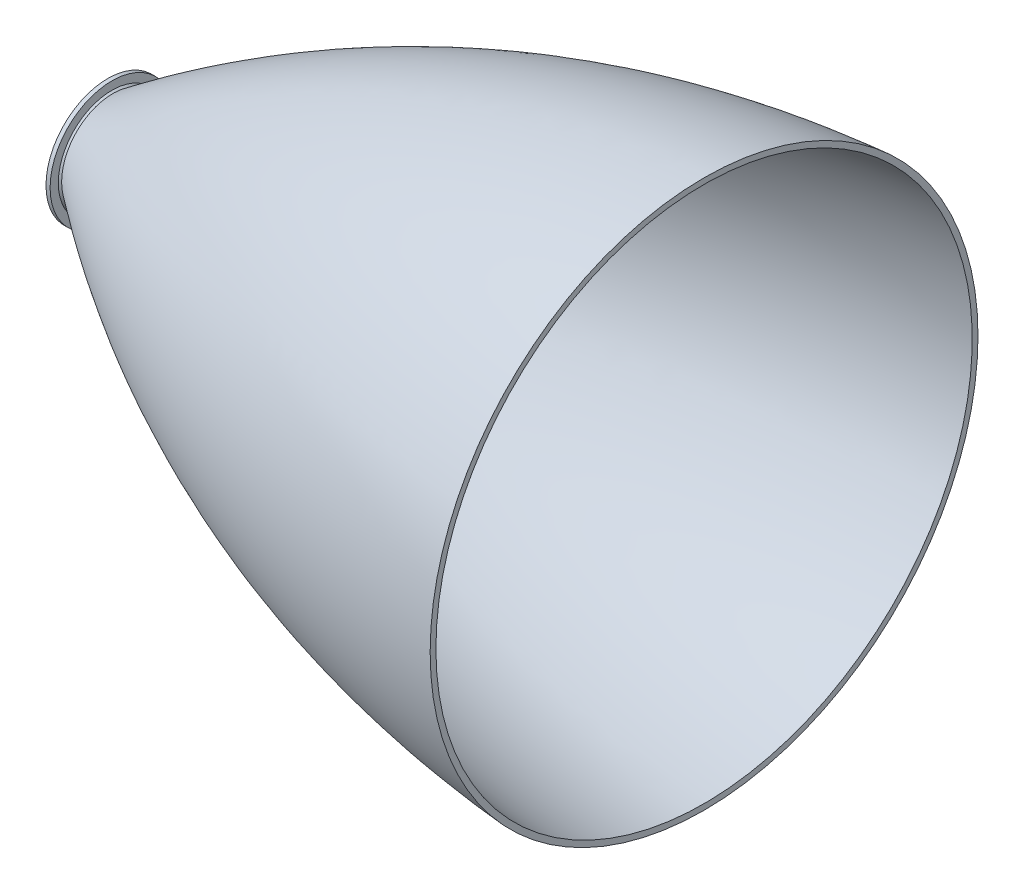
from build123d import *

# Parameters (mm, degrees)
SKETCH4_W           = 2299.140163329
SKETCH4_H           = 1084.867048291
CUT_EXTRUDE1_DEPTH  = 554.228
SKETCH5_R           = 95.504801646
SKETCH5_R_2         = 82.804801646
BOSS_EXTRUDE1_DEPTH = 6.35


with BuildPart() as part:
    # Sketch1 → Revolve3 (revolve)
    with BuildSketch(Plane.XY):
        with BuildLine():
            add(Edge.make_bspline(
                [(0, 78.994), (408.290095894, 383.61287022), (914.4, 423.545)],
                knots=[0, 0, 0, 1, 1, 1], degree=2))
            Line((914.4, 423.545), (914.4, 414.655))
            add(Edge.make_bspline(
                [(0, 70.104), (420.167251453, 366.631175918), (914.4, 414.655)],
                knots=[0, 0, 0, 1, 1, 1], degree=2))
            add(Edge.make_bspline(
                [(0, 70.104), (-195.449728047, 157.410787998), (-412.824178468, 144.809870936)],
                knots=[0, 0, 0, 1, 1, 1], degree=2))
            Line((-412.824178468, 144.809870936), (-412.824178468, 153.699870936))
            add(Edge.make_bspline(
                [(0, 78.994), (-192.730394607, 176.706088879), (-412.824178468, 153.699870936)],
                knots=[0, 0, 0, 1, 1, 1], degree=2))
        make_face()
    revolve(axis=Axis((-1229.828239288, 0, 0), (1, 0, 0)))

    # Sketch4 → Cut-Extrude1 (cut)
    with BuildSketch(Plane.ZY.offset(7.62)):
        with Locations((-63.658537287, 96.480710784)):
            Rectangle(SKETCH4_W, SKETCH4_H)
    extrude(amount=CUT_EXTRUDE1_DEPTH, mode=Mode.SUBTRACT)


with BuildPart() as body_2:
    # Sketch5 → Boss-Extrude1 (new body)
    with BuildSketch(Plane.ZY.offset(7.62)):
        Circle(SKETCH5_R)
        Circle(SKETCH5_R_2, mode=Mode.SUBTRACT)
    extrude(amount=-BOSS_EXTRUDE1_DEPTH)


solid = Compound([part.part, body_2.part])
